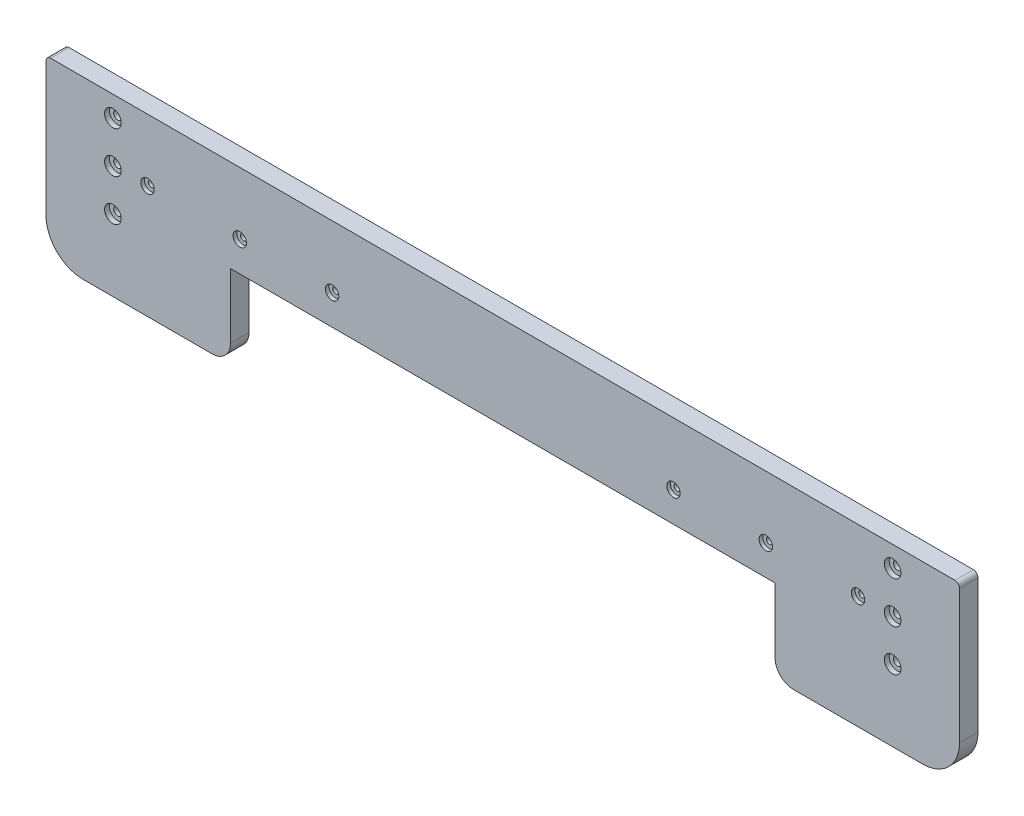
from build123d import *

# Parameters (mm, degrees)
BOSS_EXTRUDE1_DEPTH                    = 20
CBORE_FOR_M8_HEX_HEAD_BOLT1_AT_2_COUNT = 2
CBORE_FOR_M8_HEX_HEAD_BOLT1_AT_2_PITCH = 45
CBORE_FOR_M8_HEX_HEAD_BOLT1_AT_3_COUNT = 2
CBORE_FOR_M8_HEX_HEAD_BOLT1_AT_3_PITCH = 1307.399809271
CBORE_FOR_M8_HEX_HEAD_BOLT1_AT_4_COUNT = 2
CBORE_FOR_M8_HEX_HEAD_BOLT1_AT_4_PITCH = 90
CBORE_FOR_M6_HEX_HEAD_BOLT1_AT_2_COUNT = 2
CBORE_FOR_M6_HEX_HEAD_BOLT1_AT_2_PITCH = 100
CBORE_FOR_M6_HEX_HEAD_BOLT1_AT_3_COUNT = 2
CBORE_FOR_M6_HEX_HEAD_BOLT1_AT_3_PITCH = 200


with BuildPart() as part:
    # Sketch1 → Boss-Extrude1 (new body)
    with BuildSketch(Plane.XY):
        with BuildLine():
            Line((-495, 33.117706736), (-495, 178.117706736))
            ThreePointArc((-495, 178.117706736), (-493.535533906, 181.653240642), (-490, 183.117706736))
            Line((-490, 183.117706736), (490, 183.117706736))
            ThreePointArc((490, 183.117706736), (493.535533906, 181.653240642), (495, 178.117706736))
            Line((495, 178.117706736), (495, 33.117706736))
            ThreePointArc((495, 33.117706736), (483.284271247, 4.833435489), (455, -6.882293264))
            Line((455, -6.882293264), (315, -6.882293264))
            ThreePointArc((315, -6.882293264), (300.857864376, -1.024428888), (295, 13.117706736))
            Line((295, 13.117706736), (295, 83.117706736))
            Line((295, 83.117706736), (-295, 83.117706736))
            Line((-295, 83.117706736), (-295, 13.117706736))
            ThreePointArc((-295, 13.117706736), (-300.857864376, -1.024428888), (-315, -6.882293264))
            Line((-315, -6.882293264), (-455, -6.882293264))
            ThreePointArc((-455, -6.882293264), (-483.284271247, 4.833435489), (-495, 33.117706736))
        make_face()
    extrude(amount=BOSS_EXTRUDE1_DEPTH)

    # Sketch6 → CBORE for M8 Hex Head Bolt1 (revolve, cut)
    with BuildSketch(Plane(origin=(-422.5, 160.617706736, 20), x_dir=(0, -1, 0), z_dir=(1, 0, 0))):
        Polygon((0, 0), (0, 20), (4.5, 20), (4.5, 5.3), (9.0055, 5.3), (9.0055, 0.025), (9.0305, 0), align=None)
    cbore_for_m8_hex_head_bolt1 = revolve(axis=Axis((-422.5, 160.617706736, 26.35), (0, 0, -1)), mode=Mode.SUBTRACT)

    # CBORE for M8 Hex Head Bolt1 at 2: CBORE for M8 Hex Head Bolt1 ×2
    with Locations(*[(0, -i * CBORE_FOR_M8_HEX_HEAD_BOLT1_AT_2_PITCH, 0) for i in range(1, CBORE_FOR_M8_HEX_HEAD_BOLT1_AT_2_COUNT)]):
        add(cbore_for_m8_hex_head_bolt1, mode=Mode.SUBTRACT)

    # CBORE for M8 Hex Head Bolt1 at 3: CBORE for M8 Hex Head Bolt1 ×2
    with Locations(*[Vector(-0.7034023303245859, 0.710791925737724, 0) * (i * CBORE_FOR_M8_HEX_HEAD_BOLT1_AT_3_PITCH) for i in range(1, CBORE_FOR_M8_HEX_HEAD_BOLT1_AT_3_COUNT)]):
        add(cbore_for_m8_hex_head_bolt1, mode=Mode.SUBTRACT)

    # CBORE for M8 Hex Head Bolt1 at 4: CBORE for M8 Hex Head Bolt1 ×2
    with Locations(*[(0, -i * CBORE_FOR_M8_HEX_HEAD_BOLT1_AT_4_PITCH, 0) for i in range(1, CBORE_FOR_M8_HEX_HEAD_BOLT1_AT_4_COUNT)]):
        add(cbore_for_m8_hex_head_bolt1, mode=Mode.SUBTRACT)

    # Mirror1: CBORE for M8 Hex Head Bolt1 across plane
    add(cbore_for_m8_hex_head_bolt1.mirror(Plane(origin=(0, 0, 0), x_dir=(0, 0, 1), z_dir=(1, 0, 0))), mode=Mode.SUBTRACT)

    # Mirror1 copy 1 sketch → Mirror1 copy 1 (revolve, cut)
    with BuildSketch(Plane(origin=(422.5, 115.617706736, 20), x_dir=(0, -1, 0), z_dir=(-1, 0, 0))):
        Polygon((0, 0), (0, -20), (4.5, -20), (4.5, -5.3), (9.0055, -5.3), (9.0055, -0.025), (9.0305, 0), align=None)
    revolve(axis=Axis((422.5, 115.617706736, 26.35), (0, 0, 1)), mode=Mode.SUBTRACT)

    # Mirror1 copy 2 sketch → Mirror1 copy 2 (revolve, cut)
    with BuildSketch(Plane(origin=(1342.128072507, 1089.906934877, 20), x_dir=(0, -1, 0), z_dir=(-1, 0, 0))):
        Polygon((0, 0), (0, -20), (4.5, -20), (4.5, -5.3), (9.0055, -5.3), (9.0055, -0.025), (9.0305, 0), align=None)
    revolve(axis=Axis((1342.128072507, 1089.906934877, 26.35), (0, 0, 1)), mode=Mode.SUBTRACT)

    # Mirror1 copy 3 sketch → Mirror1 copy 3 (revolve, cut)
    with BuildSketch(Plane(origin=(422.5, 70.617706736, 20), x_dir=(0, -1, 0), z_dir=(-1, 0, 0))):
        Polygon((0, 0), (0, -20), (4.5, -20), (4.5, -5.3), (9.0055, -5.3), (9.0055, -0.025), (9.0305, 0), align=None)
    revolve(axis=Axis((422.5, 70.617706736, 26.35), (0, 0, 1)), mode=Mode.SUBTRACT)

    # Sketch8 → CBORE for M6 Hex Head Bolt1 (revolve, cut)
    with BuildSketch(Plane(origin=(-385, 115.617706736, 20), x_dir=(0, -1, 0), z_dir=(1, 0, 0))):
        Polygon((0, 0), (0, 20.001), (3.3, 20.001), (3.3, 4), (7.2735, 4), (7.2735, 0.025), (7.2985, 0), align=None)
    cbore_for_m6_hex_head_bolt1 = revolve(axis=Axis((-385, 115.617706736, 26.35), (0, 0, -1)), mode=Mode.SUBTRACT)

    # CBORE for M6 Hex Head Bolt1 at 2: CBORE for M6 Hex Head Bolt1 ×2
    with Locations(*[(i * CBORE_FOR_M6_HEX_HEAD_BOLT1_AT_2_PITCH, 0, 0) for i in range(1, CBORE_FOR_M6_HEX_HEAD_BOLT1_AT_2_COUNT)]):
        add(cbore_for_m6_hex_head_bolt1, mode=Mode.SUBTRACT)

    # CBORE for M6 Hex Head Bolt1 at 3: CBORE for M6 Hex Head Bolt1 ×2
    with Locations(*[(i * CBORE_FOR_M6_HEX_HEAD_BOLT1_AT_3_PITCH, 0, 0) for i in range(1, CBORE_FOR_M6_HEX_HEAD_BOLT1_AT_3_COUNT)]):
        add(cbore_for_m6_hex_head_bolt1, mode=Mode.SUBTRACT)

    # Mirror2: CBORE for M6 Hex Head Bolt1 across plane
    add(cbore_for_m6_hex_head_bolt1.mirror(Plane(origin=(0, 0, 0), x_dir=(0, 0, 1), z_dir=(1, 0, 0))), mode=Mode.SUBTRACT)

    # Mirror2 copy 1 sketch → Mirror2 copy 1 (revolve, cut)
    with BuildSketch(Plane(origin=(285, 115.617706736, 20), x_dir=(0, -1, 0), z_dir=(-1, 0, 0))):
        Polygon((0, 0), (0, -20.001), (3.3, -20.001), (3.3, -4), (7.2735, -4), (7.2735, -0.025), (7.2985, 0), align=None)
    revolve(axis=Axis((285, 115.617706736, 26.35), (0, 0, 1)), mode=Mode.SUBTRACT)

    # Mirror2 copy 2 sketch → Mirror2 copy 2 (revolve, cut)
    with BuildSketch(Plane(origin=(185, 115.617706736, 20), x_dir=(0, -1, 0), z_dir=(-1, 0, 0))):
        Polygon((0, 0), (0, -20.001), (3.3, -20.001), (3.3, -4), (7.2735, -4), (7.2735, -0.025), (7.2985, 0), align=None)
    revolve(axis=Axis((185, 115.617706736, 26.35), (0, 0, 1)), mode=Mode.SUBTRACT)


solid = part.part
